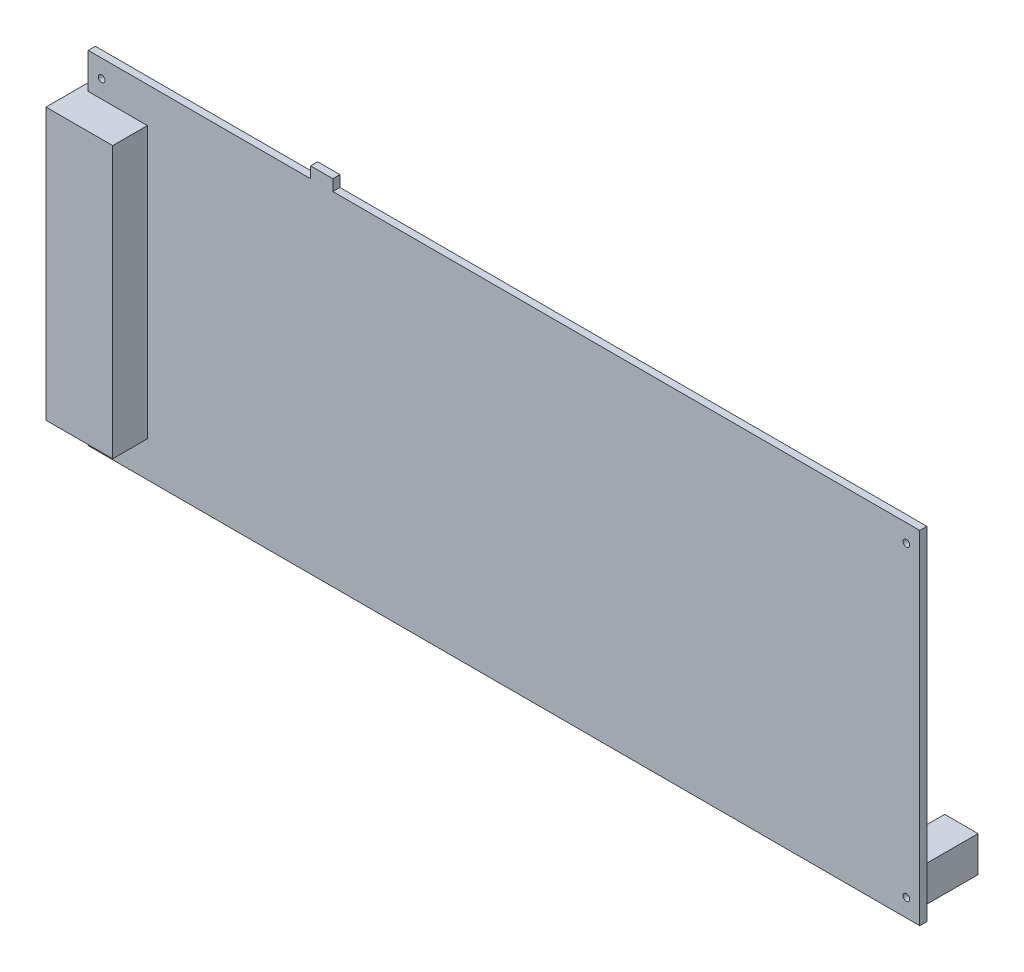
from build123d import *

# Parameters (mm, degrees)
KEEPOUTLAYER_W       = 186.9999816
KEEPOUTLAYER_H       = 76.9999984
EXTRUDE_1_DEPTH      = 1.6
VIAHOLELAYER_R       = 0.7499985
CUT_EXTRUDE_1_DEPTH  = 203.32893066
EXTRUDE_2_DEPTH      = 7.8
EXTRUDE_2_DEPTH_BACK = 9.6
SKETCH_1_W           = 15
SKETCH_1_H           = 60.9999984
SKETCH_2_W           = 5
SKETCH_2_H           = 1.6
EXTRUDE_3_DEPTH      = 2.5
SKETCH_4_W           = 7.5
SKETCH_4_H           = 8
EXTRUDE_4_DEPTH      = 16.5


with BuildPart() as part:
    # KeepOutLayer → Бобышка-Вытянуть1 (new body)
    with BuildSketch(Plane.XY):
        with Locations((93.56941662, -38.56797722)):
            Rectangle(KEEPOUTLAYER_W, KEEPOUTLAYER_H)
    extrude(amount=-EXTRUDE_1_DEPTH)

    # ViaHoleLayer → Вырез-Вытянуть1 (cut, through all)
    with BuildSketch(Plane.XY):
        with Locations((3.0693995, -73.06799966)):
            Circle(VIAHOLELAYER_R)
        with Locations((3.0693995, -4.0680005)):
            Circle(VIAHOLELAYER_R)
        with Locations((184.06940072, -73.06799966)):
            Circle(VIAHOLELAYER_R)
        with Locations((184.06940072, -4.0680005)):
            Circle(VIAHOLELAYER_R)
    extrude(amount=-CUT_EXTRUDE_1_DEPTH, mode=Mode.SUBTRACT)

    # Эскиз1 → Бобышка-Вытянуть2 (add, two sides: drawn at the far end of the back side and taken through both)
    with BuildSketch(Plane.XY.offset(-EXTRUDE_2_DEPTH_BACK)):
        with Locations((5.86942582, -38.56797722)):
            Rectangle(SKETCH_1_W, SKETCH_1_H)
    extrude(amount=EXTRUDE_2_DEPTH + EXTRUDE_2_DEPTH_BACK)

    # Эскиз2 → Бобышка-Вытянуть3 (add)
    with BuildSketch(Plane(origin=(0, -0.06797802, 0), x_dir=(1, 0, 0), z_dir=(0, 1, 0))):
        with Locations((52.56942582, 0.8)):
            Rectangle(SKETCH_2_W, SKETCH_2_H)
    extrude(amount=EXTRUDE_3_DEPTH)

    # Эскиз4 → Бобышка-Вытянуть4 (add)
    with BuildSketch(Plane(origin=(0, 0, -1.6), x_dir=(-1, 0, 0), z_dir=(0, 0, -1))):
        with Locations((-178.31940742, -74.66797642)):
            Rectangle(SKETCH_4_W, SKETCH_4_H)
    extrude(amount=EXTRUDE_4_DEPTH)


solid = part.part
